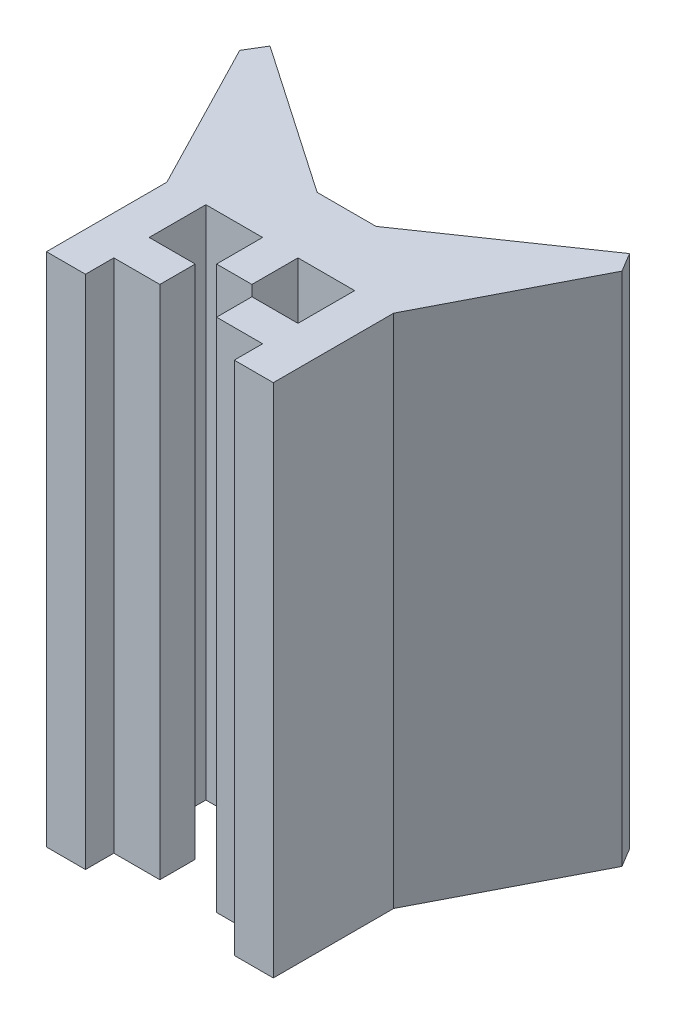
from build123d import *

# Parameters (mm, degrees)
BOSS_EXTRU_2_DEPTH = 70


with BuildPart() as part:
    # Base → Boss.-Extru.2 (new body)
    with BuildSketch(Plane(origin=(0, 0, 0), x_dir=(1, 0, 0), z_dir=(0, 1, 0))):
        Polygon((-3.85, -2.4), (-3.85, 2.4), (-10.1, 2.4), (-10.1, 10.1), (-2.4, 10.1), (-2.4, 3.85), (2.4, 3.85), (2.4, 10.1), (10.1, 10.1), (10.1, 2.4), (3.85, 2.4), (3.85, -2.4), (10.1, -2.4), (10.1, -6.247725424), (15.4, -6.247725424), (15.4, 10.102274576), (25.950506613, 30.539662134), (24.407491309, 33.11242403), (4, 19.102274576), (-4, 19.102274576), (-24.407491309, 33.11242403), (-25.950506613, 30.539662134), (-15.4, 10.102274576), (-15.4, -6.247725424), (-10.1, -6.247725424), (-10.1, -2.4), align=None)
    extrude(amount=BOSS_EXTRU_2_DEPTH)


solid = part.part
